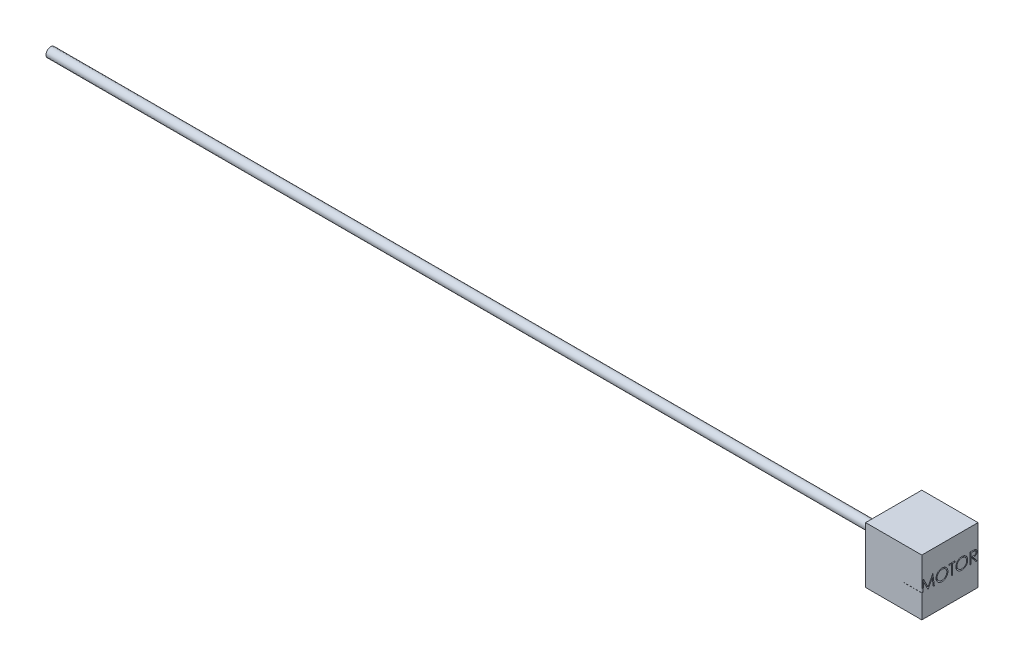
from build123d import *

# Parameters (mm, degrees)
SKETCH1_W         = 30
SKETCH1_H         = 30
MOTORBODY_DEPTH   = 30
MOTORLETTER_DEPTH = 10
SKETCH3_R         = 2.5
THREADEDROD_DEPTH = 450


with BuildPart() as part:
    # Sketch1 → MotorBody (new body)
    with BuildSketch(Plane(origin=(0, 0, 0), x_dir=(0, 0, -1), z_dir=(1, 0, 0))):
        with Locations((15, 15)):
            Rectangle(SKETCH1_W, SKETCH1_H)
    extrude(amount=-MOTORBODY_DEPTH)

    # Sketch2 → MotorLetter (cut)
    # profile 1 of 5: a face of its own
    with BuildSketch(Plane(origin=(0, 0, 0), x_dir=(0, 0, -1), z_dir=(1, 0, 0))):
        Polygon((-0.007704909, 12.470901338), (0.784362399, 18.470901338), (0.861285476, 18.470901338), (3.338448937, 13.547824415), (5.809602784, 18.470901338), (5.887727784, 18.470901338), (6.684602784, 12.470901338), (6.143737399, 12.470901338), (5.569218168, 16.788209031), (3.403352784, 12.470901338), (3.281958553, 12.470901338), (1.107679707, 16.797824415), (0.534362399, 12.470901338), align=None)
    # profile 2 of 5: a face of its own
    with BuildSketch(Plane(origin=(0, 0, 0), x_dir=(0, 0, -1), z_dir=(1, 0, 0))):
        with BuildLine():
            add(Edge.make_bspline(
                [(10.723064322, 18.624747492), (10.834163932, 18.621933528), (11.052372733, 18.616406669), (11.373072557, 18.574099634), (11.679235578, 18.500907537), (11.973355816, 18.403428139), (12.251915204, 18.273392049), (12.517010448, 18.116217509), (12.768010804, 17.930257866), (13.001533172, 17.71695062), (13.215230801, 17.484864699), (13.403503749, 17.237188281), (13.561290538, 16.975418906), (13.690866173, 16.700343196), (13.792520933, 16.412583251), (13.862667865, 16.110604961), (13.907476122, 15.796364921), (13.912714598, 15.582033153), (13.915372014, 15.473305184)],
                knots=[0, 0, 0, 0, 1.065120563, 2.091984664, 3.0946048, 4.079830382, 5.057816894, 6.036188127, 7.030412546, 8.04752943, 9.064399622, 10.05169764, 11.02544977, 11.989514704, 12.962713494, 13.945757189, 14.957906945, 16, 16, 16, 16], degree=3))
            add(Edge.make_bspline(
                [(13.915372014, 15.473305184), (13.912714987, 15.365378134), (13.907477679, 15.152641413), (13.862616917, 14.840395509), (13.792260917, 14.540240029), (13.691810175, 14.252676053), (13.562852212, 13.977400229), (13.404014776, 13.71513688), (13.216915558, 13.465800025), (13.003989527, 13.232121171), (12.771873455, 13.017839792), (12.522907284, 12.83112172), (12.262690164, 12.670451792), (11.987873521, 12.542251208), (11.702102029, 12.439785058), (11.402818047, 12.369923407), (11.091423954, 12.324859904), (10.879073662, 12.319685305), (10.771141245, 12.317055184)],
                knots=[0, 0, 0, 0, 1.043624062, 2.057103931, 3.04512605, 4.022047818, 4.998200453, 5.980619268, 6.982898556, 8.009068085, 9.034988726, 10.034168286, 11.015286542, 11.987931943, 12.962482838, 13.94673481, 14.956375938, 16, 16, 16, 16], degree=3))
            add(Edge.make_bspline(
                [(10.771141245, 12.317055184), (10.662413841, 12.319711276), (10.448083185, 12.32494714), (10.133448267, 12.369829548), (9.831257849, 12.440014641), (9.542376104, 12.540316531), (9.266641939, 12.66994607), (9.003516083, 12.828010719), (8.754054688, 13.015565819), (8.52032598, 13.228422804), (8.306470212, 13.460145464), (8.120025568, 13.708432759), (7.961925373, 13.968413541), (7.832731089, 14.240809297), (7.730449159, 14.524303199), (7.66066947, 14.820786303), (7.615522124, 15.128568313), (7.61031953, 15.338127567), (7.607679707, 15.444459031)],
                knots=[0, 0, 0, 0, 1.053102029, 2.075944431, 3.073151272, 4.055350789, 5.033113405, 6.020478099, 7.024410459, 8.052272461, 9.079885166, 10.07527673, 11.055994387, 12.023226415, 12.992069828, 13.970394897, 14.97016774, 16, 16, 16, 16], degree=3))
            add(Edge.make_bspline(
                [(7.607679707, 15.444459031), (7.608596225, 15.515829321), (7.610417698, 15.657669532), (7.632346314, 15.86829799), (7.664166373, 16.075539117), (7.709769652, 16.2788036), (7.76941251, 16.477593859), (7.839787414, 16.673280881), (7.925741434, 16.86388155), (8.02290826, 17.050298793), (8.131357073, 17.229626632), (8.251144072, 17.399134489), (8.378061847, 17.560244769), (8.517199093, 17.70878249), (8.663970142, 17.849068758), (8.820755933, 17.978947701), (8.986599781, 18.099590474), (9.162215289, 18.208311059), (9.343275189, 18.306641004), (9.529921093, 18.39102132), (9.719618073, 18.46344314), (9.913254612, 18.522141697), (10.110316507, 18.56848233), (10.311233852, 18.600037794), (10.515846583, 18.622022339), (10.653694558, 18.623835199), (10.723064322, 18.624747492)],
                knots=[0, 0, 0, 0, 1.037015668, 2.060948919, 3.074880161, 4.083647147, 5.086022904, 6.090072063, 7.104153813, 8.122640571, 9.144368836, 10.147691507, 11.138137339, 12.123020368, 13.103399296, 14.087645067, 15.080126199, 16.082011238, 17.087798457, 18.072939717, 19.057185487, 20.037253025, 21.01195951, 21.997135196, 22.992090687, 24, 24, 24, 24], degree=3))
        make_face()
        with BuildLine():
            add(Edge.make_bspline(
                [(10.74950663, 18.009362877), (10.692567258, 18.008668779), (10.579232859, 18.00728722), (10.410745082, 17.98908885), (10.244473196, 17.963151898), (10.08038286, 17.926155005), (9.91916065, 17.875748057), (9.75930378, 17.817735072), (9.602269973, 17.747070345), (9.448577645, 17.667231423), (9.299580373, 17.578861845), (9.158987171, 17.481195958), (9.026434067, 17.376524151), (8.90224561, 17.264602144), (8.786786458, 17.14485997), (8.677784112, 17.019112936), (8.579607687, 16.883766837), (8.489632412, 16.742491854), (8.409116114, 16.595472001), (8.337518363, 16.444255094), (8.278951491, 16.287607631), (8.231187418, 16.127229075), (8.191587742, 15.96337343), (8.166501015, 15.794797689), (8.148102684, 15.622348926), (8.146800092, 15.505808604), (8.146141245, 15.446862877)],
                knots=[0, 0, 0, 0, 1.008559885, 2.007477868, 2.99961109, 3.989939068, 4.984837346, 5.991145699, 7.001802488, 8.033829008, 9.059044045, 10.069351652, 11.065060232, 12.050310815, 13.029377138, 14.011219647, 14.996725999, 15.989392538, 16.977580475, 17.965360261, 18.951710183, 19.937753436, 20.929683414, 21.935841486, 22.955955122, 24, 24, 24, 24], degree=3))
            add(Edge.make_bspline(
                [(8.146141245, 15.446862877), (8.148326723, 15.360184784), (8.152626233, 15.189662161), (8.190267782, 14.939773914), (8.24824831, 14.699622566), (8.333718081, 14.47052215), (8.440604849, 14.250503379), (8.572650946, 14.041518057), (8.729095093, 13.843509701), (8.906803996, 13.657860669), (9.101071493, 13.488410718), (9.307356173, 13.339673446), (9.523448071, 13.213827304), (9.749910705, 13.111304323), (9.985535057, 13.030064772), (10.23183943, 12.974387119), (10.487183075, 12.937743481), (10.661235627, 12.934224471), (10.74950663, 12.9324398)],
                knots=[0, 0, 0, 0, 1.032063989, 2.030389145, 3.003944642, 3.970395727, 4.937377036, 5.913328081, 6.909231446, 7.93887556, 8.970685674, 9.976071282, 10.964166581, 11.944589148, 12.933237628, 13.927779006, 14.949070134, 16, 16, 16, 16], degree=3))
            add(Edge.make_bspline(
                [(10.74950663, 12.9324398), (10.808837204, 12.93325495), (10.926507552, 12.934871638), (11.101528447, 12.951155084), (11.273396239, 12.97726686), (11.441869862, 13.01486227), (11.60675811, 13.061914624), (11.768749201, 13.117813586), (11.926117698, 13.187552792), (12.080848849, 13.264606424), (12.228956692, 13.352446694), (12.370343319, 13.446797807), (12.501444998, 13.551315443), (12.625540549, 13.66157455), (12.741473731, 13.779798289), (12.848460561, 13.905832955), (12.946140787, 14.040474082), (13.036081896, 14.181534778), (13.11631606, 14.328956925), (13.186223087, 14.480722087), (13.245530714, 14.63645656), (13.293408151, 14.796384969), (13.330926086, 14.960203567), (13.356777377, 15.128131701), (13.374860415, 15.29983343), (13.376223404, 15.415965755), (13.376910476, 15.474507108)],
                knots=[0, 0, 0, 0, 1.047197238, 2.076906641, 3.100256066, 4.114471768, 5.12198147, 6.126382909, 7.136867548, 8.15857795, 9.17633901, 10.174870724, 11.156907918, 12.133735059, 13.104061851, 14.077631395, 15.04955518, 16.038496417, 17.029181396, 18.010275684, 18.986308667, 19.968651475, 20.955262928, 21.950658345, 22.966943676, 24, 24, 24, 24], degree=3))
            add(Edge.make_bspline(
                [(13.376910476, 15.474507108), (13.376222854, 15.532647972), (13.374858828, 15.647981087), (13.356786015, 15.818485347), (13.330898774, 15.985205138), (13.293591274, 16.147485943), (13.245505297, 16.305369129), (13.18621273, 16.45870641), (13.116295074, 16.608069031), (13.036052404, 16.753087825), (12.945853849, 16.892244519), (12.847292289, 17.025277226), (12.738665978, 17.14968764), (12.623078507, 17.268547116), (12.497642703, 17.379320641), (12.362926771, 17.482044962), (12.22056618, 17.579199146), (12.069833777, 17.666842966), (11.914272713, 17.747781651), (11.754648785, 17.817126228), (11.592770329, 17.876049861), (11.429048993, 17.926307516), (11.262106745, 17.963006996), (11.09307161, 17.989112224), (10.922177452, 18.007280886), (10.807246218, 18.008666677), (10.74950663, 18.009362877)],
                knots=[0, 0, 0, 0, 1.02996197, 2.043119294, 3.035359645, 4.018872909, 4.991431989, 5.957985074, 6.929999688, 7.912076566, 8.892894881, 9.867085534, 10.843653904, 11.817741046, 12.803660682, 13.806313499, 14.818574707, 15.856120519, 16.894564902, 17.924820532, 18.937903209, 19.946497019, 20.957711757, 21.963978472, 22.977135795, 24, 24, 24, 24], degree=3))
        make_face(mode=Mode.SUBTRACT)
    # profile 3 of 5: a face of its own
    with BuildSketch(Plane(origin=(0, 0, 0), x_dir=(0, 0, -1), z_dir=(1, 0, 0))):
        Polygon((14.453833553, 17.855516723), (14.453833553, 18.470901338), (17.607679707, 18.470901338), (17.607679707, 17.855516723), (16.299987399, 17.855516723), (16.299987399, 12.470901338), (15.76152586, 12.470901338), (15.76152586, 17.855516723), align=None)
    # profile 4 of 5: a face of its own
    with BuildSketch(Plane(origin=(0, 0, 0), x_dir=(0, 0, -1), z_dir=(1, 0, 0))):
        with BuildLine():
            add(Edge.make_bspline(
                [(21.338448937, 18.624747492), (21.449548548, 18.621933528), (21.667757348, 18.616406669), (21.988457173, 18.574099634), (22.294620193, 18.500907537), (22.588740431, 18.403428139), (22.86729982, 18.273392049), (23.132395064, 18.116217509), (23.383395419, 17.930257866), (23.616917787, 17.71695062), (23.830615416, 17.484864699), (24.018888364, 17.237188281), (24.176675153, 16.975418906), (24.306250789, 16.700343196), (24.407905548, 16.412583251), (24.47805248, 16.110604961), (24.522860738, 15.796364921), (24.528099213, 15.582033153), (24.53075663, 15.473305184)],
                knots=[0, 0, 0, 0, 1.065120563, 2.091984664, 3.0946048, 4.079830382, 5.057816894, 6.036188127, 7.030412546, 8.04752943, 9.064399622, 10.05169764, 11.02544977, 11.989514704, 12.962713494, 13.945757189, 14.957906945, 16, 16, 16, 16], degree=3))
            add(Edge.make_bspline(
                [(24.53075663, 15.473305184), (24.528099603, 15.365378134), (24.522862294, 15.152641413), (24.478001533, 14.840395509), (24.407645533, 14.540240029), (24.307194791, 14.252676053), (24.178236828, 13.977400229), (24.019399391, 13.71513688), (23.832300173, 13.465800025), (23.619374143, 13.232121171), (23.387258071, 13.017839792), (23.138291899, 12.83112172), (22.878074779, 12.670451792), (22.603258136, 12.542251208), (22.317486645, 12.439785058), (22.018202662, 12.369923407), (21.70680857, 12.324859904), (21.494458277, 12.319685305), (21.38652586, 12.317055184)],
                knots=[0, 0, 0, 0, 1.043624062, 2.057103931, 3.04512605, 4.022047818, 4.998200453, 5.980619268, 6.982898556, 8.009068085, 9.034988726, 10.034168286, 11.015286542, 11.987931943, 12.962482838, 13.94673481, 14.956375938, 16, 16, 16, 16], degree=3))
            add(Edge.make_bspline(
                [(21.38652586, 12.317055184), (21.277798457, 12.319711276), (21.063467801, 12.32494714), (20.748832883, 12.369829548), (20.446642465, 12.440014641), (20.15776072, 12.540316531), (19.882026555, 12.66994607), (19.618900699, 12.828010719), (19.369439304, 13.015565819), (19.135710595, 13.228422804), (18.921854827, 13.460145464), (18.735410183, 13.708432759), (18.577309989, 13.968413541), (18.448115704, 14.240809297), (18.345833774, 14.524303199), (18.276054086, 14.820786303), (18.230906739, 15.128568313), (18.225704145, 15.338127567), (18.223064322, 15.444459031)],
                knots=[0, 0, 0, 0, 1.053102029, 2.075944431, 3.073151272, 4.055350789, 5.033113405, 6.020478099, 7.024410459, 8.052272461, 9.079885166, 10.07527673, 11.055994387, 12.023226415, 12.992069828, 13.970394897, 14.97016774, 16, 16, 16, 16], degree=3))
            add(Edge.make_bspline(
                [(18.223064322, 15.444459031), (18.22398084, 15.515829321), (18.225802314, 15.657669532), (18.247730929, 15.86829799), (18.279550989, 16.075539117), (18.325154267, 16.2788036), (18.384797125, 16.477593859), (18.455172029, 16.673280881), (18.54112605, 16.86388155), (18.638292875, 17.050298793), (18.746741689, 17.229626632), (18.866528688, 17.399134489), (18.993446462, 17.560244769), (19.132583708, 17.70878249), (19.279354757, 17.849068758), (19.436140548, 17.978947701), (19.601984396, 18.099590474), (19.777599904, 18.208311059), (19.958659804, 18.306641004), (20.145305709, 18.39102132), (20.335002688, 18.46344314), (20.528639228, 18.522141697), (20.725701123, 18.56848233), (20.926618468, 18.600037794), (21.131231198, 18.622022339), (21.269079174, 18.623835199), (21.338448937, 18.624747492)],
                knots=[0, 0, 0, 0, 1.037015668, 2.060948919, 3.074880161, 4.083647147, 5.086022904, 6.090072063, 7.104153813, 8.122640571, 9.144368836, 10.147691507, 11.138137339, 12.123020368, 13.103399296, 14.087645067, 15.080126199, 16.082011238, 17.087798457, 18.072939717, 19.057185487, 20.037253025, 21.01195951, 21.997135196, 22.992090687, 24, 24, 24, 24], degree=3))
        make_face()
        with BuildLine():
            add(Edge.make_bspline(
                [(21.364891245, 18.009362877), (21.307951873, 18.008668779), (21.194617474, 18.00728722), (21.026129698, 17.98908885), (20.859857811, 17.963151898), (20.695767476, 17.926155005), (20.534545266, 17.875748057), (20.374688395, 17.817735072), (20.217654588, 17.747070345), (20.063962261, 17.667231423), (19.914964989, 17.578861845), (19.774371786, 17.481195958), (19.641818682, 17.376524151), (19.517630225, 17.264602144), (19.402171073, 17.14485997), (19.293168728, 17.019112936), (19.194992302, 16.883766837), (19.105017027, 16.742491854), (19.02450073, 16.595472001), (18.952902979, 16.444255094), (18.894336107, 16.287607631), (18.846572033, 16.127229075), (18.806972357, 15.96337343), (18.78188563, 15.794797689), (18.7634873, 15.622348926), (18.762184708, 15.505808604), (18.76152586, 15.446862877)],
                knots=[0, 0, 0, 0, 1.008559885, 2.007477868, 2.99961109, 3.989939068, 4.984837346, 5.991145699, 7.001802488, 8.033829008, 9.059044045, 10.069351652, 11.065060232, 12.050310815, 13.029377138, 14.011219647, 14.996725999, 15.989392538, 16.977580475, 17.965360261, 18.951710183, 19.937753436, 20.929683414, 21.935841486, 22.955955122, 24, 24, 24, 24], degree=3))
            add(Edge.make_bspline(
                [(18.76152586, 15.446862877), (18.763711338, 15.360184784), (18.768010849, 15.189662161), (18.805652398, 14.939773914), (18.863632925, 14.699622566), (18.949102696, 14.47052215), (19.055989464, 14.250503379), (19.188035562, 14.041518057), (19.344479708, 13.843509701), (19.522188611, 13.657860669), (19.716456108, 13.488410718), (19.922740788, 13.339673446), (20.138832687, 13.213827304), (20.36529532, 13.111304323), (20.600919673, 13.030064772), (20.847224046, 12.974387119), (21.102567691, 12.937743481), (21.276620242, 12.934224471), (21.364891245, 12.9324398)],
                knots=[0, 0, 0, 0, 1.032063989, 2.030389145, 3.003944642, 3.970395727, 4.937377036, 5.913328081, 6.909231446, 7.93887556, 8.970685674, 9.976071282, 10.964166581, 11.944589148, 12.933237628, 13.927779006, 14.949070134, 16, 16, 16, 16], degree=3))
            add(Edge.make_bspline(
                [(21.364891245, 12.9324398), (21.424221819, 12.93325495), (21.541892167, 12.934871638), (21.716913063, 12.951155084), (21.888780854, 12.97726686), (22.057254477, 13.01486227), (22.222142725, 13.061914624), (22.384133816, 13.117813586), (22.541502314, 13.187552792), (22.696233464, 13.264606424), (22.844341307, 13.352446694), (22.985727934, 13.446797807), (23.116829614, 13.551315443), (23.240925165, 13.66157455), (23.356858346, 13.779798289), (23.463845176, 13.905832955), (23.561525403, 14.040474082), (23.651466511, 14.181534778), (23.731700676, 14.328956925), (23.801607703, 14.480722087), (23.86091533, 14.63645656), (23.908792767, 14.796384969), (23.946310701, 14.960203567), (23.972161992, 15.128131701), (23.99024503, 15.29983343), (23.991608019, 15.415965755), (23.992295091, 15.474507108)],
                knots=[0, 0, 0, 0, 1.047197238, 2.076906641, 3.100256066, 4.114471768, 5.12198147, 6.126382909, 7.136867548, 8.15857795, 9.17633901, 10.174870724, 11.156907918, 12.133735059, 13.104061851, 14.077631395, 15.04955518, 16.038496417, 17.029181396, 18.010275684, 18.986308667, 19.968651475, 20.955262928, 21.950658345, 22.966943676, 24, 24, 24, 24], degree=3))
            add(Edge.make_bspline(
                [(23.992295091, 15.474507108), (23.991607469, 15.532647972), (23.990243444, 15.647981087), (23.97217063, 15.818485347), (23.946283389, 15.985205138), (23.90897589, 16.147485943), (23.860889912, 16.305369129), (23.801597346, 16.45870641), (23.731679689, 16.608069031), (23.651437019, 16.753087825), (23.561238464, 16.892244519), (23.462676905, 17.025277226), (23.354050593, 17.14968764), (23.238463122, 17.268547116), (23.113027319, 17.379320641), (22.978311386, 17.482044962), (22.835950796, 17.579199146), (22.685218392, 17.666842966), (22.529657329, 17.747781651), (22.370033401, 17.817126228), (22.208154944, 17.876049861), (22.044433609, 17.926307516), (21.87749136, 17.963006996), (21.708456225, 17.989112224), (21.537562067, 18.007280886), (21.422630834, 18.008666677), (21.364891245, 18.009362877)],
                knots=[0, 0, 0, 0, 1.02996197, 2.043119294, 3.035359645, 4.018872909, 4.991431989, 5.957985074, 6.929999688, 7.912076566, 8.892894881, 9.867085534, 10.843653904, 11.817741046, 12.803660682, 13.806313499, 14.818574707, 15.856120519, 16.894564902, 17.924820532, 18.937903209, 19.946497019, 20.957711757, 21.963978472, 22.977135795, 24, 24, 24, 24], degree=3))
        make_face(mode=Mode.SUBTRACT)
    # profile 5 of 5: a face of its own
    with BuildSketch(Plane(origin=(0, 0, 0), x_dir=(0, 0, -1), z_dir=(1, 0, 0))):
        with BuildLine():
            Line((25.76152586, 18.470901338), (26.962247014, 18.470901338))
            add(Edge.make_bspline(
                [(26.962247014, 18.470901338), (27.042374663, 18.470634619), (27.196228625, 18.47012249), (27.416639946, 18.467266896), (27.616914969, 18.459082286), (27.796948979, 18.452039), (27.956738674, 18.439195672), (28.096774029, 18.426920277), (28.216410082, 18.410851145), (28.288831541, 18.395927562), (28.321622014, 18.389170569)],
                knots=[0, 0, 0, 0, 1.410062039, 2.707475311, 3.878576406, 4.937260626, 5.877586885, 6.699081471, 7.410979367, 8, 8, 8, 8], degree=3))
            add(Edge.make_bspline(
                [(28.321622014, 18.389170569), (28.365519084, 18.378324686), (28.452376781, 18.356864291), (28.577434037, 18.311504975), (28.696601449, 18.25901419), (28.809384005, 18.197362098), (28.91521679, 18.126091047), (29.015191037, 18.046431409), (29.109760403, 17.958819056), (29.19510034, 17.861045042), (29.275567286, 17.758468168), (29.343433503, 17.647547442), (29.40193604, 17.531556252), (29.448514069, 17.409314965), (29.486019166, 17.28200907), (29.512464148, 17.148485418), (29.528323327, 17.009352318), (29.529937936, 16.914453046), (29.53075663, 16.866334031)],
                knots=[0, 0, 0, 0, 1.027469482, 2.033020251, 3.019912614, 3.986113645, 4.951240523, 5.91722682, 6.890402269, 7.87763091, 8.8651537, 9.85103654, 10.82876324, 11.815024772, 12.821070561, 13.842952187, 14.906261191, 16, 16, 16, 16], degree=3))
            add(Edge.make_bspline(
                [(29.53075663, 16.866334031), (29.528238347, 16.786388137), (29.523324526, 16.630392992), (29.477510062, 16.40400291), (29.4024646, 16.192821227), (29.299053247, 15.997113848), (29.167362718, 15.820695599), (29.009091647, 15.665740533), (28.824151742, 15.536072111), (28.6519872, 15.446153017), (28.499905715, 15.388565174), (28.37470575, 15.348045702), (28.238133789, 15.316739475), (28.091498358, 15.288693535), (27.934189234, 15.267519202), (27.766583453, 15.252010754), (27.588561478, 15.242318099), (27.466265931, 15.240874662), (27.403352784, 15.240132108)],
                knots=[0, 0, 0, 0, 1.260483769, 2.459530307, 3.627416485, 4.787058657, 5.939039949, 7.08810263, 8.267026773, 9.491475466, 10.141966685, 10.831826277, 11.566392101, 12.351337768, 13.187381173, 14.07005841, 15.007169909, 16, 16, 16, 16], degree=3))
            Line((27.403352784, 15.240132108), (29.607679707, 12.470901338))
            Line((29.607679707, 12.470901338), (28.941814322, 12.470901338))
            Line((28.941814322, 12.470901338), (26.737487399, 15.240132108))
            Line((26.737487399, 15.240132108), (26.299987399, 15.240132108))
            Line((26.299987399, 15.240132108), (26.299987399, 12.470901338))
            Line((26.299987399, 12.470901338), (25.76152586, 12.470901338))
            Line((25.76152586, 12.470901338), (25.76152586, 18.470901338))
        make_face()
        with BuildLine():
            Line((26.299987399, 17.855516723), (26.299987399, 15.855516723))
            Line((26.299987399, 15.855516723), (27.398545091, 15.847103261))
            add(Edge.make_bspline(
                [(27.398545091, 15.847103261), (27.449836587, 15.84708057), (27.549254113, 15.847036588), (27.693083824, 15.853883061), (27.827004016, 15.861671607), (27.950502448, 15.87358477), (28.063634291, 15.888938036), (28.166343, 15.908143152), (28.258796232, 15.930518117), (28.366622297, 15.965149475), (28.48702778, 16.020016935), (28.617881711, 16.099843504), (28.72931429, 16.200247709), (28.823459197, 16.315059347), (28.899109651, 16.441292917), (28.952444601, 16.577435264), (28.986288788, 16.720049432), (28.99028058, 16.818069046), (28.992295091, 16.867535954)],
                knots=[0, 0, 0, 0, 1.146690395, 2.22261258, 3.21895312, 4.145990853, 4.996080663, 5.770904154, 6.481378293, 7.121626537, 8.300444488, 9.431385265, 10.535395872, 11.636531494, 12.74115979, 13.810798291, 14.895190096, 16, 16, 16, 16], degree=3))
            add(Edge.make_bspline(
                [(28.992295091, 16.867535954), (28.990234312, 16.915787223), (28.9861506, 17.011403632), (28.952809854, 17.151385193), (28.896428058, 17.283499964), (28.820447078, 17.40721051), (28.727877098, 17.519506057), (28.619332277, 17.615586891), (28.497780513, 17.694871688), (28.384172745, 17.74553634), (28.282628381, 17.776598945), (28.194463249, 17.798458083), (28.094843573, 17.81602003), (27.983285644, 17.830090992), (27.860265705, 17.842185182), (27.725161732, 17.850331088), (27.578870109, 17.855154855), (27.47747537, 17.855393293), (27.424987399, 17.855516723)],
                knots=[0, 0, 0, 0, 1.101028733, 2.181837193, 3.264309656, 4.369019818, 5.486613113, 6.575447106, 7.666700264, 8.788928104, 9.402425223, 10.0903467, 10.862060571, 11.710948788, 12.657782767, 13.684531032, 14.801375019, 16, 16, 16, 16], degree=3))
            Line((27.424987399, 17.855516723), (26.299987399, 17.855516723))
        make_face(mode=Mode.SUBTRACT)
    extrude(amount=-MOTORLETTER_DEPTH, mode=Mode.SUBTRACT)

    # Sketch3 → ThreadedRod (add)
    with BuildSketch(Plane.ZY.offset(30)):
        with Locations((-15, 15)):
            Circle(SKETCH3_R)
    extrude(amount=THREADEDROD_DEPTH)


solid = part.part
